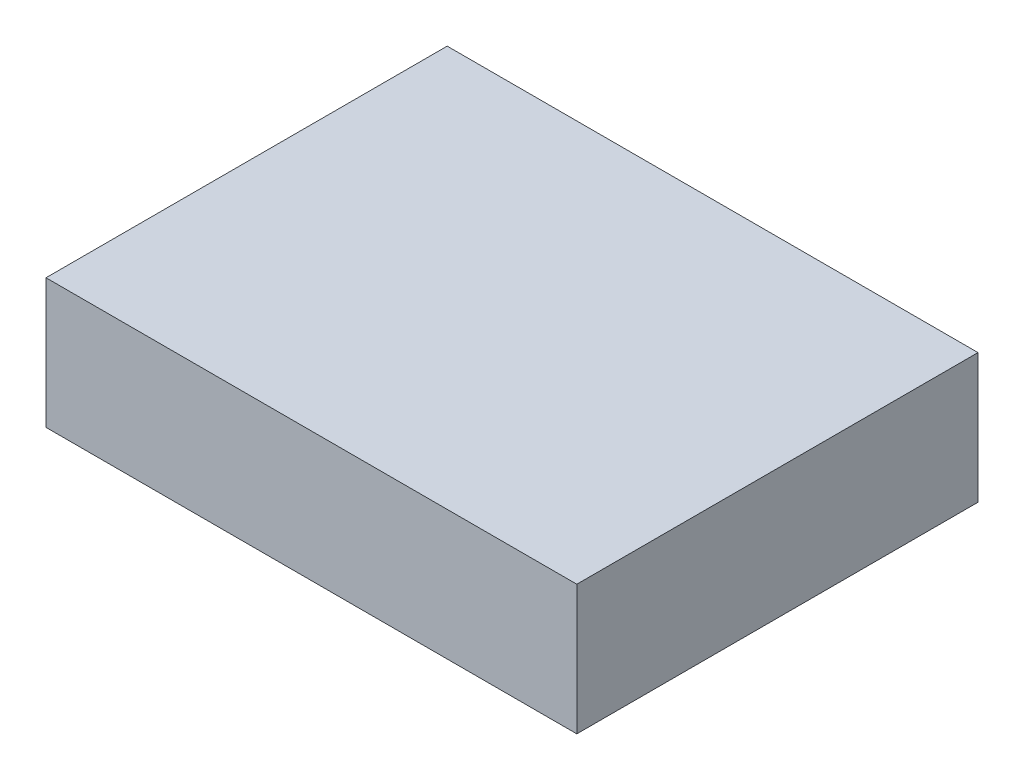
from build123d import *

# Parameters (mm, degrees)
SKETCH_1_W      = 86
SKETCH_1_H      = 65
EXTRUDE_1_DEPTH = 21


with BuildPart() as part:
    # 草图1 → 凸台-拉伸1 (new body)
    with BuildSketch(Plane(origin=(0, 0, 0), x_dir=(1, 0, 0), z_dir=(0, 1, 0))):
        Rectangle(SKETCH_1_W, SKETCH_1_H)
    extrude(amount=EXTRUDE_1_DEPTH)


solid = part.part
